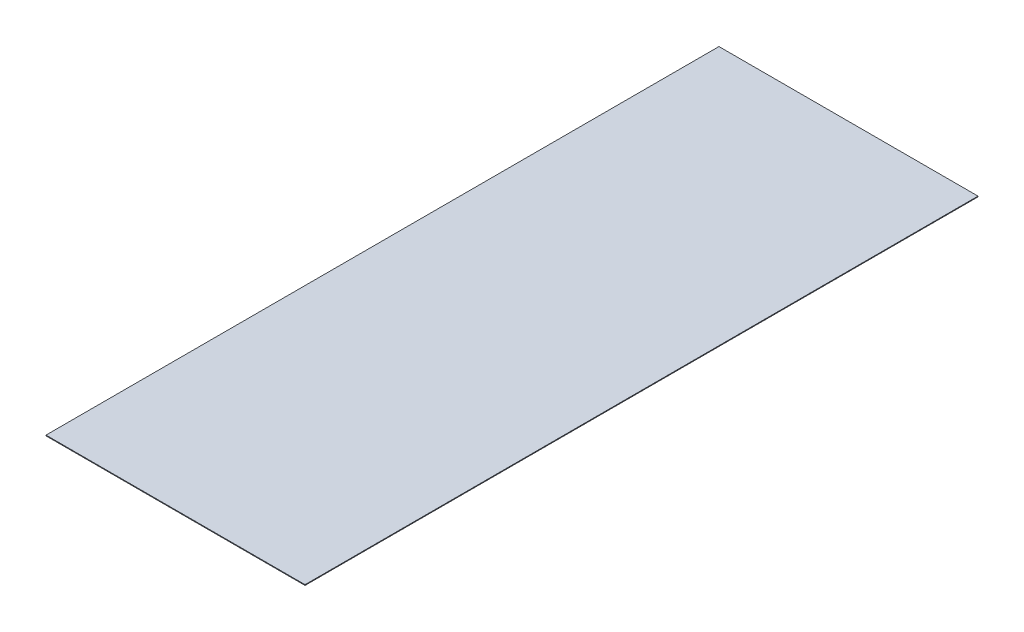
from build123d import *

# Parameters (mm, degrees)
SKETCH1_W           = 184
SKETCH1_H           = 478
BOSS_EXTRUDE1_DEPTH = 0.5


with BuildPart() as part:
    # Sketch1 → Boss-Extrude1 (new body)
    with BuildSketch(Plane(origin=(0, 0, 0), x_dir=(1, 0, 0), z_dir=(0, 1, 0))):
        with Locations((92, 239)):
            Rectangle(SKETCH1_W, SKETCH1_H)
    extrude(amount=BOSS_EXTRUDE1_DEPTH)


solid = part.part
